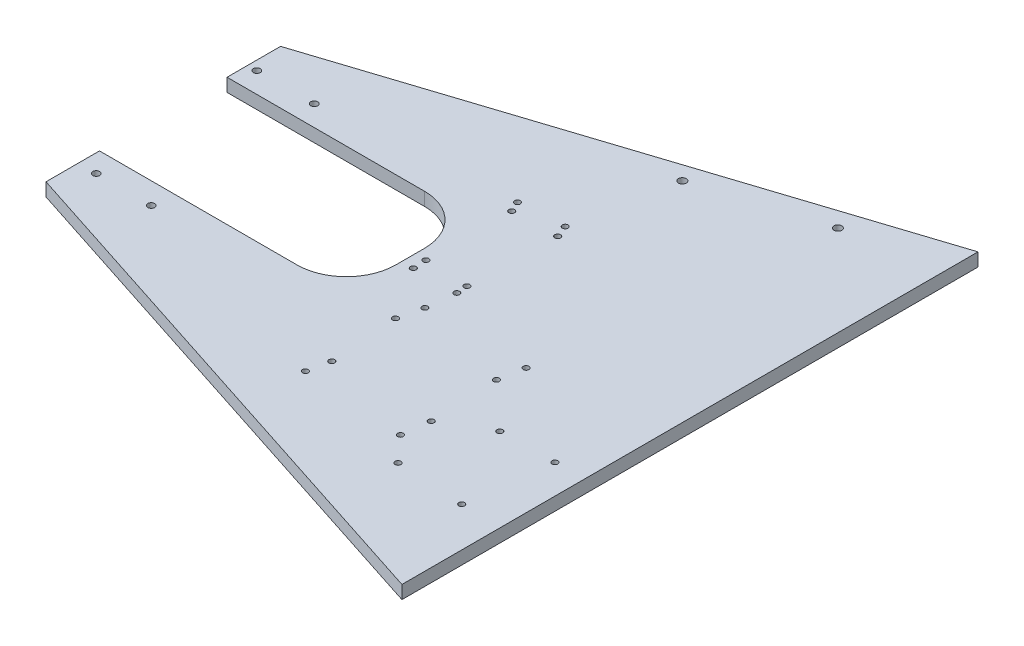
from build123d import *

# Parameters (mm, degrees)
BOSS_EXTRUDE1_DEPTH = 16
FILLET1_R           = 60
SKETCH3_R           = 3.5
SKETCH3_R_2         = 4.25
SKETCH3_R_3         = 4.75
CUT_EXTRUDE1_DEPTH  = 475.506058971


with BuildPart() as part:
    # Sketch2 → Boss-Extrude1 (new body)
    with BuildSketch(Plane(origin=(0, 0, 0), x_dir=(1, 0, 0), z_dir=(0, 1, 0))):
        Polygon((-320, 142.5), (320, 350), (320, -350), (-320, -142.5), (-320, -77.5), (-20, -77.5), (-20, 77.5), (-320, 77.5), align=None)
    extrude(amount=-BOSS_EXTRUDE1_DEPTH)

    # Fillet1
    fillet1_edges = [part.edges().sort_by_distance(p)[0] for p in [
        (-20, -8, 77.5),
        (-20, -8, -77.5),
    ]]
    fillet(fillet1_edges, radius=FILLET1_R)

    # Sketch3 → Cut-Extrude1 (cut, through all)
    with BuildSketch(Plane(origin=(0, 0, 0), x_dir=(1, 0, 0), z_dir=(0, 1, 0))):
        with Locations(Location((45.573061117, 3.35862906, 0), (0, 0, 90))):
            Circle(SKETCH3_R)
        with Locations(Location((-231.09322879, -103.556104562, 0), (0, 0, 90))):
            Circle(SKETCH3_R_2)
        with Locations(Location((-298.17988721, -103.306000096, 0), (0, 0, 90))):
            Circle(SKETCH3_R_2)
        with Locations(Location((42.566176502, -157.759098005, 0), (0, 0, 90))):
            Circle(SKETCH3_R)
        with Locations(Location((36.930918819, -184.234632929, 0), (0, 0, 90))):
            Circle(SKETCH3_R)
        with Locations(Location((271.893921884, -229.22367877, 0), (0, 0, 90))):
            Circle(SKETCH3_R)
        with Locations(Location((189.782320405, -224.480960591, 0), (0, 0, 90))):
            Circle(SKETCH3_R)
        with Locations(Location((161.703177467, -193.571367621, 0), (0, 0, 90))):
            Circle(SKETCH3_R)
        with Locations(Location((165.959633732, -160.391798843, 0), (0, 0, 90))):
            Circle(SKETCH3_R)
        with Locations(Location((218.334544159, -129.392881806, 0), (0, 0, 90))):
            Circle(SKETCH3_R)
        with Locations(Location((284.479489307, -128.626354194, 0), (0, 0, 90))):
            Circle(SKETCH3_R)
        with Locations(Location((167.618318747, -46.69664923, 0), (0, 0, 90))):
            Circle(SKETCH3_R)
        with Locations(Location((162.099631238, -77.233713281, 0), (0, 0, 90))):
            Circle(SKETCH3_R)
        with Locations(Location((36.088570732, -73.915788734, 0), (0, 0, 90))):
            Circle(SKETCH3_R)
        with Locations(Location((42.875486949, -45.054299224, 0), (0, 0, 90))):
            Circle(SKETCH3_R)
        with Locations(Location((46.585239341, -9.907029228, 0), (0, 0, 90))):
            Circle(SKETCH3_R)
        with Locations(Location((-5.911515538, -10.255507999, 0), (0, 0, 90))):
            Circle(SKETCH3_R)
        with Locations(Location((65.684970424, 245.110909603, 0), (0, 0, 90))):
            Circle(SKETCH3_R_3)
        with Locations(Location((209.819274537, 289.932963664, 0), (0, 0, 90))):
            Circle(SKETCH3_R_3)
        with Locations(Location((-239.124203173, 102.548612385, 0), (0, 0, 90))):
            Circle(SKETCH3_R_2)
        with Locations(Location((-308.888078303, 102.548612385, 0), (0, 0, 90))):
            Circle(SKETCH3_R_2)
        with Locations(Location((42.566176502, 125.814947371, 0), (0, 0, 90))):
            Circle(SKETCH3_R)
        with Locations(Location((-11.908905398, 122.350563935, 0), (0, 0, 90))):
            Circle(SKETCH3_R)
        with Locations(Location((48.286557876, 110.984487849, 0), (0, 0, 90))):
            Circle(SKETCH3_R)
        with Locations(Location((-6.149033448, 109.550848491, 0), (0, 0, 90))):
            Circle(SKETCH3_R)
        with Locations(Location((-6.697602275, 5.835495982, 0), (0, 0, 90))):
            Circle(SKETCH3_R)
    extrude(amount=-CUT_EXTRUDE1_DEPTH, mode=Mode.SUBTRACT)


solid = part.part
